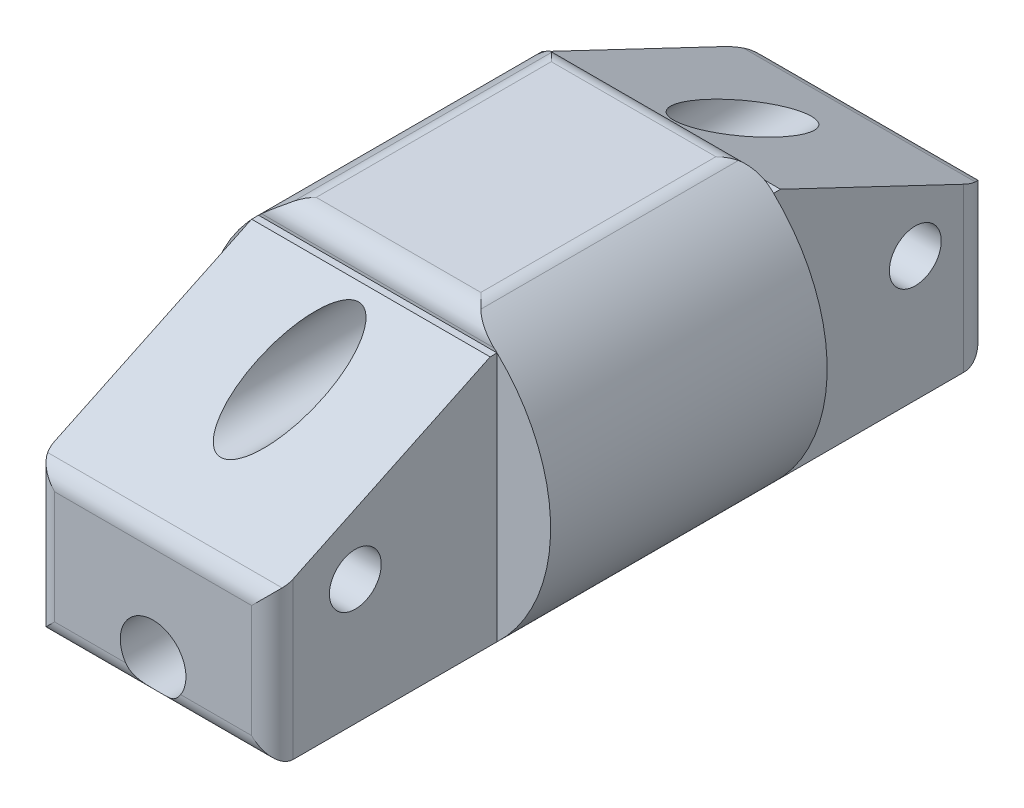
from build123d import *

# Parameters (mm, degrees)
SKETCH1_R               = 12.7
FINGERBODY_DEPTH        = 20.32
SKETCH2_W               = 17.526
SKETCH2_H               = 18.384757926
BOSS_EXTRUDE2_DEPTH     = 16.51
SKETCH4_R               = 1.905
CUT_EXTRUDE2_DEPTH      = 45.479200409
CUT_EXTRUDE3_DEPTH      = 45.479200409
FILLET2_R               = 2.54
CUT_EXTRUDE5_DEPTH      = 41.975955144
FILLET3_R               = 1.524
FILLET4_R               = 1.524
FILLET6_R               = 1.524
CUT_EXTRUDE6_DEPTH      = 41.460214887
CUT_EXTRUDE6_DEPTH_BACK = 41.460214887
SKETCH11_R              = 2.413


with BuildPart() as part:
    # Sketch1 → FingerBody (new body)
    with BuildSketch(Plane.XY):
        Circle(SKETCH1_R)
    extrude(amount=FINGERBODY_DEPTH)

    # Sketch2 → Boss-Extrude2 (add)
    with BuildSketch(Plane(origin=(0, 0, 0), x_dir=(-1, 0, 0), z_dir=(0, 0, -1))):
        Rectangle(SKETCH2_W, SKETCH2_H)
    boss_extrude2 = extrude(amount=BOSS_EXTRUDE2_DEPTH)

    # Mirror1: Boss-Extrude2 across plane
    add(boss_extrude2.mirror(Plane(origin=(0, 0, 10.16), x_dir=(1, 0, 0), z_dir=(0, 0, -1))))

    # Sketch4 → Cut-Extrude2 (cut, through all)
    with BuildSketch(Plane.ZY.offset(8.763)):
        with Locations(Location((30.734, 0, 0), (0, 0, 270))):
            Circle(SKETCH4_R)
    cut_extrude2 = extrude(amount=-CUT_EXTRUDE2_DEPTH, mode=Mode.SUBTRACT)

    # Mirror2: Cut-Extrude2 across plane
    add(cut_extrude2.mirror(Plane(origin=(0, 0, 10.16), x_dir=(1, 0, 0), z_dir=(0, 0, -1))), mode=Mode.SUBTRACT)

    # Sketch5 → Cut-Extrude3 (cut, through all)
    with BuildSketch(Plane(origin=(8.763, 0, 0), x_dir=(0, 0, -1), z_dir=(1, 0, 0))):
        Polygon((16.51, 1.572378963), (0.508, 9.192378963), (16.51, 9.192378963), align=None)
    cut_extrude3 = extrude(amount=-CUT_EXTRUDE3_DEPTH, mode=Mode.SUBTRACT)

    # Fillet2
    fillet2_edges = [part.edges().sort_by_distance(p)[0] for p in [
        (0, -9.192378963, -16.51),
        (8.763, -3.81, -16.51),
        (0, 1.572378963, -16.51),
        (-8.763, -3.81, -16.51),
    ]]
    fillet(fillet2_edges, radius=FILLET2_R)

    # Mirror6: Cut-Extrude3 across plane
    add(cut_extrude3.mirror(Plane(origin=(0, 0, 10.16), x_dir=(1, 0, 0), z_dir=(0, 0, -1))), mode=Mode.SUBTRACT)

    # Sketch8 → Cut-Extrude5 (cut, symmetric)
    with BuildSketch(Plane(origin=(0, 0, 0), x_dir=(-1, 0, 0), z_dir=(0, 0, -1))):
        with BuildLine():
            Line((6.480734218, 10.922), (-6.480734218, 10.922))
            ThreePointArc((-6.480734218, 10.922), (0, 12.7), (6.480734218, 10.922))
        make_face()
    cut_extrude5 = extrude(amount=CUT_EXTRUDE5_DEPTH, both=True, mode=Mode.SUBTRACT)

    # Mirror7: Cut-Extrude5 across plane
    add(cut_extrude5.mirror(Plane(origin=(0, 0, 0), x_dir=(0, 0, 1), z_dir=(0, -1, 0))), mode=Mode.SUBTRACT)

    # Fillet3
    fillet3_edges = [part.edges().sort_by_distance(p)[0] for p in [
        (6.480734218, 10.922, 10.16),
        (-6.480734218, 10.922, 10.16),
        (0, 10.922, 20.32),
        (0, 10.922, 0),
    ]]
    fillet(fillet3_edges, radius=FILLET3_R)

    # Fillet4
    fillet4_edges = [part.edges().sort_by_distance(p)[0] for p in [
        (6.480734218, -10.922, 10.16),
        (-6.480734218, -10.922, 10.16),
        (0, -10.922, 20.32),
        (0, -10.922, 0),
    ]]
    fillet(fillet4_edges, radius=FILLET4_R)

    # Fillet6
    fillet6_edges = [part.edges().sort_by_distance(p)[0] for p in [
        (-8.763, -3.81, 36.83),
        (0, -9.192378963, 36.83),
        (8.763, -3.81, 36.83),
        (0, 1.572378963, 36.83),
    ]]
    fillet(fillet6_edges, radius=FILLET6_R)

    # Sketch11 → Cut-Extrude6 (cut, two sides: drawn at the far end of the back side and taken through both)
    with BuildSketch(Plane.XY.offset(20.32).offset(-CUT_EXTRUDE6_DEPTH_BACK)):
        with Locations(Location((0, 6.35, 0), (0, 0, 270))):
            Circle(SKETCH11_R)
        with Locations(Location((0, -6.35, 0), (0, 0, 352.801199766))):
            Circle(SKETCH11_R)
    extrude(amount=CUT_EXTRUDE6_DEPTH + CUT_EXTRUDE6_DEPTH_BACK, mode=Mode.SUBTRACT)


solid = part.part
